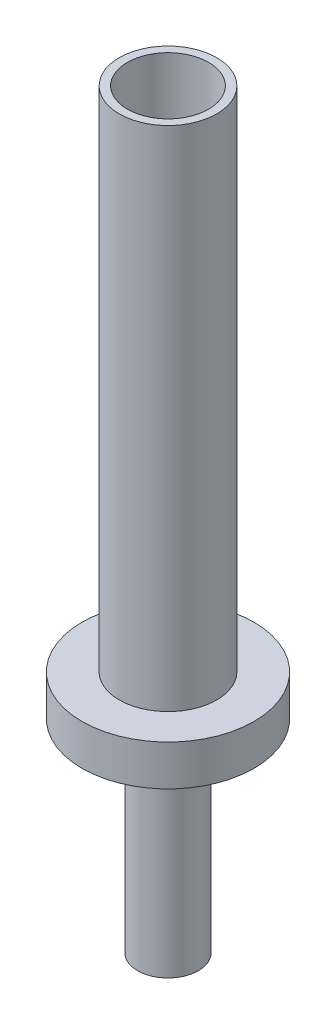
from build123d import *

# Parameters (mm, degrees)
SKETCH1_R           = 7.5
BOSS_EXTRUDE1_DEPTH = 50
SKETCH2_R           = 21.183921509
BOSS_EXTRUDE2_DEPTH = 10
SKETCH3_R           = 12
SKETCH3_R_2         = 10
BOSS_EXTRUDE3_DEPTH = 125


with BuildPart() as part:
    # Sketch1 → Boss-Extrude1 (new body)
    with BuildSketch(Plane(origin=(0, 0, 0), x_dir=(1, 0, 0), z_dir=(0, 1, 0))):
        with Locations(Location((0, 0, 0), (0, 0, 270))):
            Circle(SKETCH1_R)
    extrude(amount=BOSS_EXTRUDE1_DEPTH)

    # Sketch2 → Boss-Extrude2 (add)
    with BuildSketch(Plane(origin=(0, 50, 0), x_dir=(1, 0, 0), z_dir=(0, 1, 0))):
        with Locations(Location((0, 0, 0), (0, 0, 270))):
            Circle(SKETCH2_R)
    extrude(amount=BOSS_EXTRUDE2_DEPTH)

    # Sketch3 → Boss-Extrude3 (add)
    with BuildSketch(Plane(origin=(0, 60, 0), x_dir=(1, 0, 0), z_dir=(0, 1, 0))):
        with Locations(Location((0, 0, 0), (0, 0, 270))):
            Circle(SKETCH3_R)
        with Locations(Location((0, 0, 0), (0, 0, 270))):
            Circle(SKETCH3_R_2, mode=Mode.SUBTRACT)
    extrude(amount=BOSS_EXTRUDE3_DEPTH)


solid = part.part
